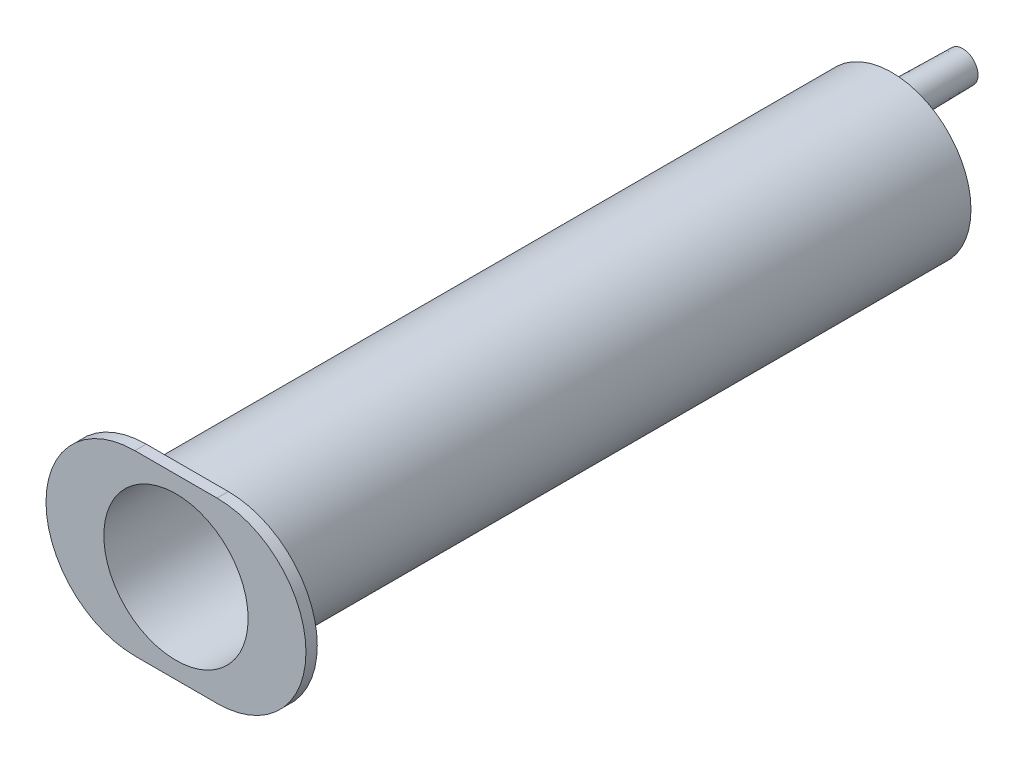
from build123d import *

# Parameters (mm, degrees)
SKETCH1_R           = 10.5
BOSS_EXTRUDE1_DEPTH = 95
BOSS_EXTRUDE2_DEPTH = 1.5
SKETCH3_R           = 2.2
BOSS_EXTRUDE3_DEPTH = 9.4
BOSS_EXTRUDE3_TAPER = 1
SKETCH4_R           = 9.575
CUT_EXTRUDE1_DEPTH  = 93.5
SKETCH5_R           = 1
CUT_EXTRUDE2_DEPTH  = 107.471416352


with BuildPart() as part:
    # Sketch1 → Boss-Extrude1 (new body)
    with BuildSketch(Plane.XY):
        Circle(SKETCH1_R)
    extrude(amount=BOSS_EXTRUDE1_DEPTH)

    # Sketch2 → Boss-Extrude2 (add)
    with BuildSketch(Plane.XY.offset(95)):
        with BuildLine():
            Line((5.45, -11.8), (-5.45, -11.8))
            ThreePointArc((-5.45, -11.8), (-17.25, 0), (-5.45, 11.8))
            Line((-5.45, 11.8), (5.45, 11.8))
            ThreePointArc((5.45, 11.8), (17.25, 0), (5.45, -11.8))
        make_face()
    extrude(amount=-BOSS_EXTRUDE2_DEPTH)

    # Sketch3 → Boss-Extrude3 (add)
    with BuildSketch(Plane(origin=(0, 0, 0), x_dir=(-1, 0, 0), z_dir=(0, 0, -1))):
        with Locations((0, 6.5)):
            Circle(SKETCH3_R)
    extrude(amount=BOSS_EXTRUDE3_DEPTH, taper=BOSS_EXTRUDE3_TAPER)

    # Sketch4 → Cut-Extrude1 (cut)
    with BuildSketch(Plane.XY.offset(95)):
        Circle(SKETCH4_R)
    extrude(amount=-CUT_EXTRUDE1_DEPTH, mode=Mode.SUBTRACT)

    # Sketch5 → Cut-Extrude2 (cut, through all)
    with BuildSketch(Plane(origin=(0, 0, -9.4), x_dir=(-1, 0, 0), z_dir=(0, 0, -1))):
        with Locations((0, 6.5)):
            Circle(SKETCH5_R)
    extrude(amount=-CUT_EXTRUDE2_DEPTH, mode=Mode.SUBTRACT)


solid = part.part
